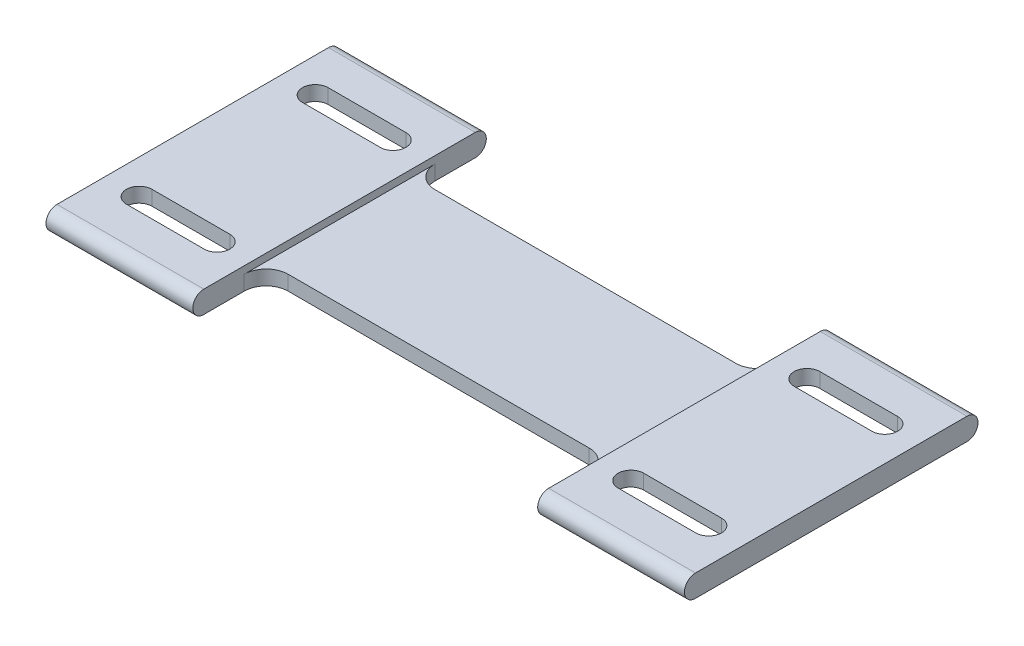
from build123d import *

# Parameters (mm, degrees)
EXTRUDE_1_DEPTH     = 43.5
SKETCH_3_W          = 47
SKETCH_3_H          = 40
CUT_EXTRUDE_1_DEPTH = 1
SKETCH_4_W          = 47
SKETCH_4_H          = 16.028408988
CUT_EXTRUDE_2_DEPTH = 48.919202831
CUT_EXTRUDE_3_DEPTH = 48.971345614
CUT_EXTRUDE_4_DEPTH = 1
FILLET_1_R          = 3


with BuildPart() as part:
    # 草图2 → 凸台-拉伸1 (new, symmetric)
    with BuildSketch(Plane(origin=(0, 0, 0), x_dir=(0, 0, -1), z_dir=(1, 0, 0))):
        with BuildLine():
            Line((-18.5, 1.5), (18.5, 1.5))
            ThreePointArc((18.5, 1.5), (20, 0), (18.5, -1.5))
            Line((18.5, -1.5), (-18.5, -1.5))
            ThreePointArc((-18.5, -1.5), (-20, 0), (-18.5, 1.5))
        make_face()
    extrude(amount=EXTRUDE_1_DEPTH, both=True)

    # 草图3 → 切除-拉伸1 (cut)
    with BuildSketch(Plane(origin=(0, 1.5, 0), x_dir=(1, 0, 0), z_dir=(0, 1, 0))):
        Rectangle(SKETCH_3_W, SKETCH_3_H)
    extrude(amount=-CUT_EXTRUDE_1_DEPTH, mode=Mode.SUBTRACT)

    # 草图4 → 切除-拉伸2 (cut, through all)
    with BuildSketch(Plane(origin=(0, 0.5, 0), x_dir=(1, 0, 0), z_dir=(0, 1, 0))):
        with Locations((0, 18.008457368)):
            Rectangle(SKETCH_4_W, SKETCH_4_H)
        with Locations((0, -18.008457368)):
            Rectangle(SKETCH_4_W, SKETCH_4_H)
    extrude(amount=-CUT_EXTRUDE_2_DEPTH, mode=Mode.SUBTRACT)

    # 草图5 → 切除-拉伸3 (cut, through all)
    with BuildSketch(Plane(origin=(0, -1.5, 0), x_dir=(-1, 0, 0), z_dir=(0, -1, 0))):
        with BuildLine():
            Line((38.8, -13.75), (28.2, -13.75))
            ThreePointArc((28.2, -13.75), (26.45, -12), (28.2, -10.25))
            Line((28.2, -10.25), (38.8, -10.25))
            ThreePointArc((38.8, -10.25), (40.55, -12), (38.8, -13.75))
        make_face()
        with BuildLine():
            Line((38.8, 13.75), (28.2, 13.75))
            ThreePointArc((28.2, 13.75), (26.45, 12), (28.2, 10.25))
            Line((28.2, 10.25), (38.8, 10.25))
            ThreePointArc((38.8, 10.25), (40.55, 12), (38.8, 13.75))
        make_face()
        with BuildLine():
            Line((-38.8, 13.75), (-28.2, 13.75))
            ThreePointArc((-28.2, 13.75), (-26.45, 12), (-28.2, 10.25))
            Line((-28.2, 10.25), (-38.8, 10.25))
            ThreePointArc((-38.8, 10.25), (-40.55, 12), (-38.8, 13.75))
        make_face()
        with BuildLine():
            Line((-38.8, -13.75), (-28.2, -13.75))
            ThreePointArc((-28.2, -13.75), (-26.45, -12), (-28.2, -10.25))
            Line((-28.2, -10.25), (-38.8, -10.25))
            ThreePointArc((-38.8, -10.25), (-40.55, -12), (-38.8, -13.75))
        make_face()
    extrude(amount=-CUT_EXTRUDE_3_DEPTH, mode=Mode.SUBTRACT)

    # 草图6 → 切除-拉伸4 (cut)
    with BuildSketch(Plane.XZ.offset(1.5)):
        with BuildLine():
            Line((-28.2, 15.75), (-38.8, 15.75))
            ThreePointArc((-38.8, 15.75), (-42.55, 12), (-38.8, 8.25))
            Line((-38.8, 8.25), (-28.2, 8.25))
            ThreePointArc((-28.2, 8.25), (-24.45, 12), (-28.2, 15.75))
        make_face()
        with BuildLine():
            Line((-38.8, -15.75), (-28.2, -15.75))
            ThreePointArc((-28.2, -15.75), (-24.45, -12), (-28.2, -8.25))
            Line((-28.2, -8.25), (-38.8, -8.25))
            ThreePointArc((-38.8, -8.25), (-42.55, -12), (-38.8, -15.75))
        make_face()
        with BuildLine():
            Line((38.8, 15.75), (28.2, 15.75))
            ThreePointArc((28.2, 15.75), (24.45, 12), (28.2, 8.25))
            Line((28.2, 8.25), (38.8, 8.25))
            ThreePointArc((38.8, 8.25), (42.55, 12), (38.8, 15.75))
        make_face()
        with BuildLine():
            Line((28.2, -15.75), (38.8, -15.75))
            ThreePointArc((38.8, -15.75), (42.55, -12), (38.8, -8.25))
            Line((38.8, -8.25), (28.2, -8.25))
            ThreePointArc((28.2, -8.25), (24.45, -12), (28.2, -15.75))
        make_face()
    extrude(amount=-CUT_EXTRUDE_4_DEPTH, mode=Mode.SUBTRACT)

    # 圆角1
    fillet_1_edges = [part.edges().sort_by_distance(p)[0] for p in [
        (-23.5, -0.5, -9.994252874),
        (23.5, -0.5, -9.994252874),
        (23.5, -0.5, 9.994252874),
        (-23.5, -0.5, 9.994252874),
    ]]
    fillet(fillet_1_edges, radius=FILLET_1_R)


solid = part.part
